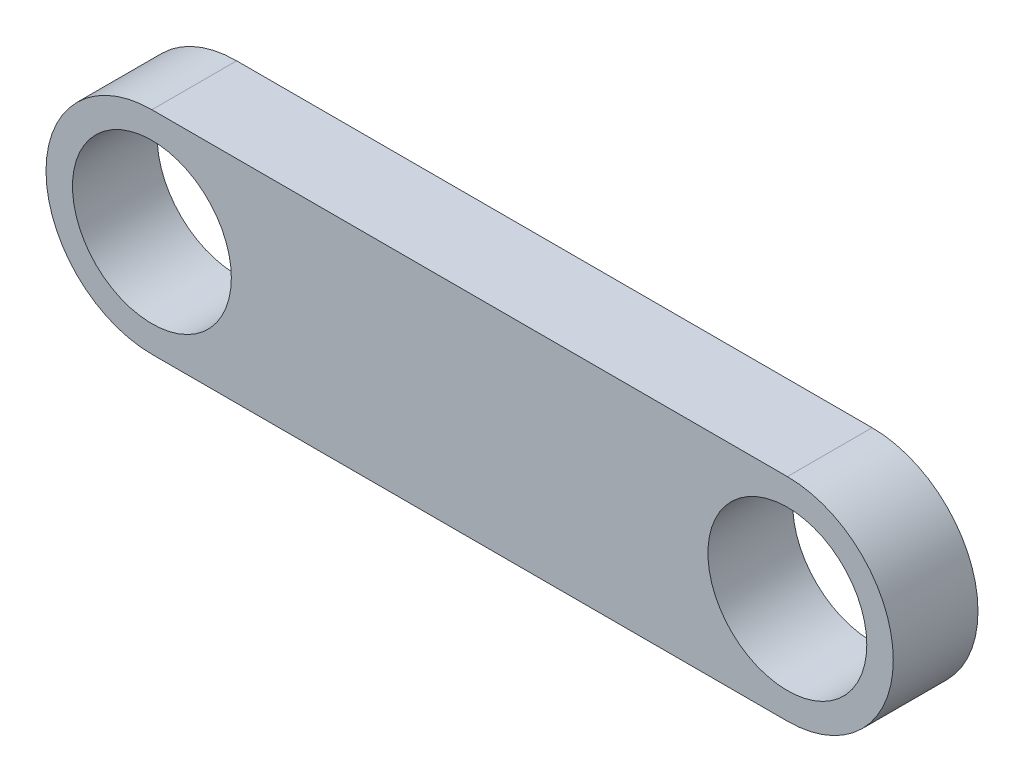
from build123d import *

# Parameters (mm, degrees)
BOSS_EXTRUDE1_DEPTH      = 40
BOSS_EXTRUDE1_DEPTH_BACK = 40
CUT_EXTRUDE1_DEPTH       = 200
CUT_EXTRUDE1_DEPTH_BACK  = 200
SKETCH7_R                = 75
CUT_EXTRUDE2_DEPTH       = 200
CUT_EXTRUDE2_DEPTH_BACK  = 200
SKETCH8_R                = 75


with BuildPart() as part:
    # Sketch2 → Boss-Extrude1 (new, two sides: drawn at the far end of the back side and taken through both)
    with BuildSketch(Plane.XY.offset(-BOSS_EXTRUDE1_DEPTH_BACK)):
        with BuildLine():
            Line((600, 100), (0, 100))
            ThreePointArc((0, 100), (-100, 0), (0, -100))
            Line((0, -100), (600, -100))
            ThreePointArc((600, -100), (700, 0), (600, 100))
        make_face()
    extrude(amount=BOSS_EXTRUDE1_DEPTH + BOSS_EXTRUDE1_DEPTH_BACK)

    # Sketch7 → Cut-Extrude1 (cut, two sides: drawn at the far end of the back side and taken through both)
    with BuildSketch(Plane.XY.offset(-CUT_EXTRUDE1_DEPTH_BACK)):
        Circle(SKETCH7_R)
    extrude(amount=CUT_EXTRUDE1_DEPTH + CUT_EXTRUDE1_DEPTH_BACK, mode=Mode.SUBTRACT)

    # Sketch8 → Cut-Extrude2 (cut, two sides: drawn at the far end of the back side and taken through both)
    with BuildSketch(Plane.XY.offset(-CUT_EXTRUDE2_DEPTH_BACK)):
        with Locations((600, 0)):
            Circle(SKETCH8_R)
    extrude(amount=CUT_EXTRUDE2_DEPTH + CUT_EXTRUDE2_DEPTH_BACK, mode=Mode.SUBTRACT)


solid = part.part
